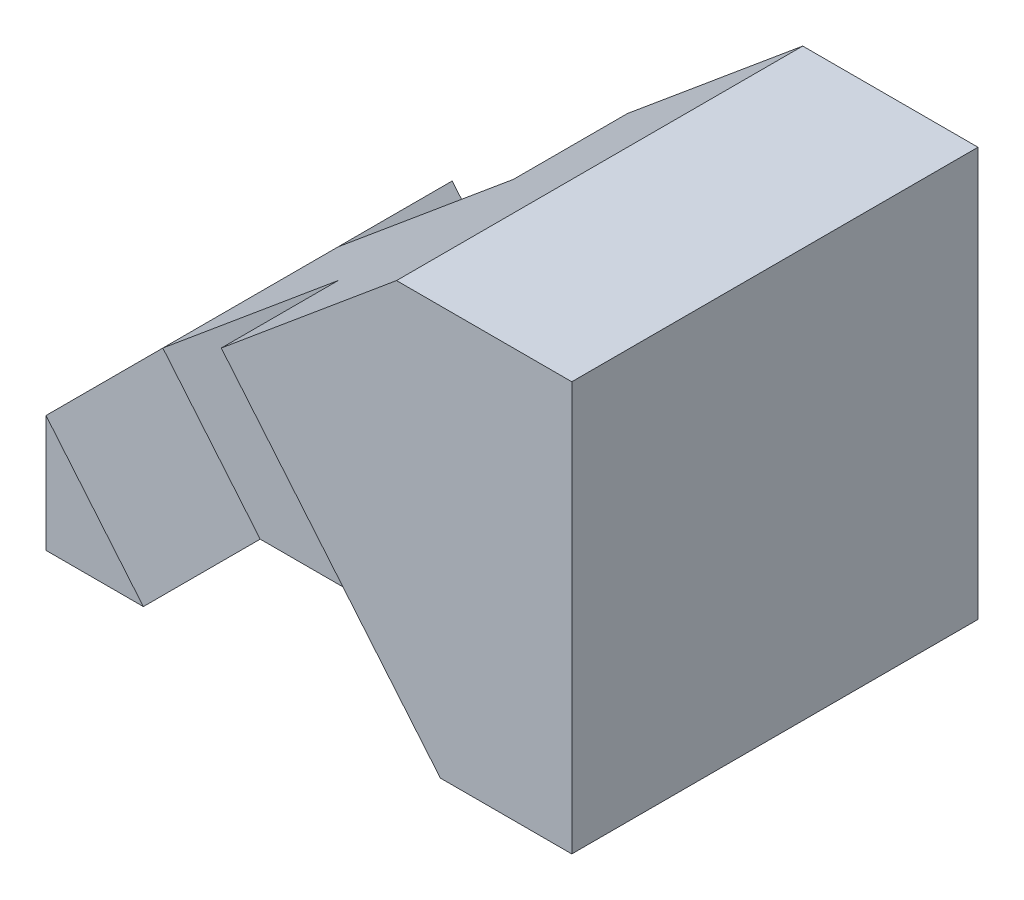
from build123d import *

# Parameters (mm, degrees)
BOSS_EXTRUDE1_DEPTH = 34766.002952666
SKETCH2_W           = 19525.624189766
SKETCH2_H           = 10000
SKETCH2_H_2         = 9766.002952666
CUT_EXTRUDE1_DEPTH  = 34999


with BuildPart() as part:
    # Sketch1 → Boss-Extrude1 (new body)
    with BuildSketch(Plane.XY):
        Polygon((0, 10000), (0, 0), (15000, 0), (15000, 22500), align=None)
        Polygon((15000, 22500), (15000, 0), (15913.464519056, 0), (45000, 0), (45000, 35000), (30000, 35000), align=None)
    extrude(amount=BOSS_EXTRUDE1_DEPTH)

    # Sketch2 → Cut-Extrude1 (cut)
    with BuildSketch(Plane(origin=(-4918.032786885, 5901.639344262, 0), x_dir=(0.7682212795973759, 0.6401843996644799, 0), z_dir=(-0.6401843996644799, 0.768221279597376, 0))):
        with Locations((16164.656091528, -29766.002952666)):
            Rectangle(SKETCH2_W, SKETCH2_H)
        with Locations((16164.656091528, -4883.001476333)):
            Rectangle(SKETCH2_W, SKETCH2_H_2)
    extrude(amount=-CUT_EXTRUDE1_DEPTH, mode=Mode.SUBTRACT)


solid = part.part
